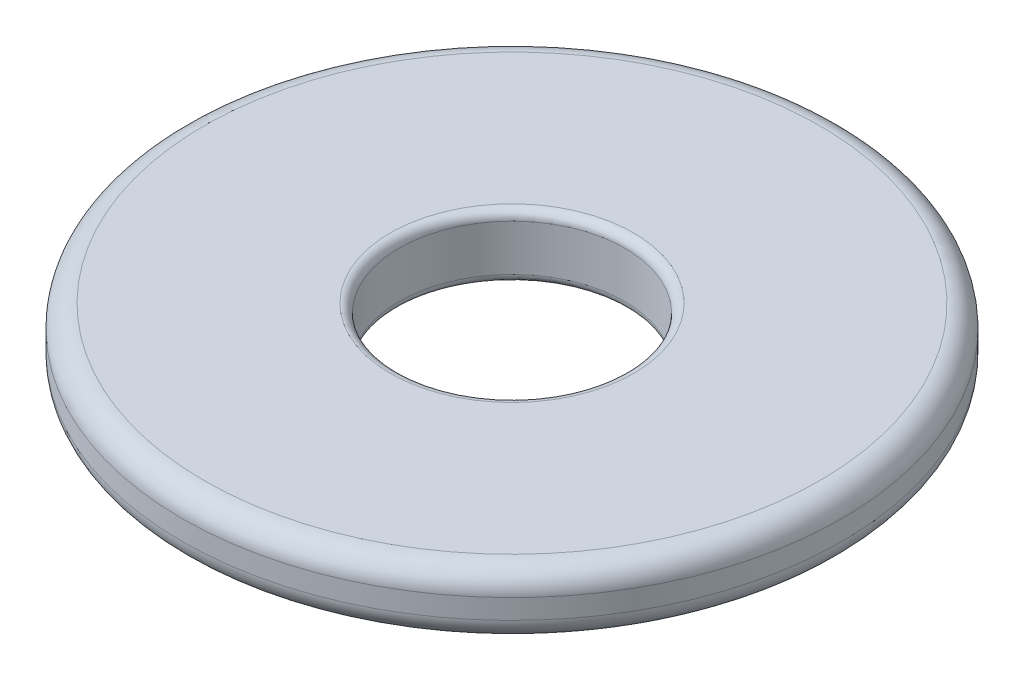
from build123d import *

# Parameters (mm, degrees)
SKETCH1_R           = 9.525
SKETCH1_R_2         = 3.2639
BOSS_EXTRUDE1_DEPTH = 1.8415
FILLET1_R           = 0.635
FILLET2_R           = 0.254


with BuildPart() as part:
    # Sketch1 → Boss-Extrude1 (new body)
    with BuildSketch(Plane(origin=(0, 0, 0), x_dir=(1, 0, 0), z_dir=(0, 1, 0))):
        with Locations(Location((0, 0, 0), (0, 0, 270))):
            Circle(SKETCH1_R)
        with Locations(Location((0, 0, 0), (0, 0, 270))):
            Circle(SKETCH1_R_2, mode=Mode.SUBTRACT)
    extrude(amount=BOSS_EXTRUDE1_DEPTH)

    # Fillet1
    fillet1_edges = [part.edges().sort_by_distance(p)[0] for p in [
        (0, 0, -9.525),
        (0, 1.8415, -9.525),
    ]]
    fillet(fillet1_edges, radius=FILLET1_R)

    # Fillet2
    fillet2_edges = [part.edges().sort_by_distance(p)[0] for p in [
        (0, 0, -3.2639),
        (0, 1.8415, -3.2639),
    ]]
    fillet(fillet2_edges, radius=FILLET2_R)


solid = part.part
